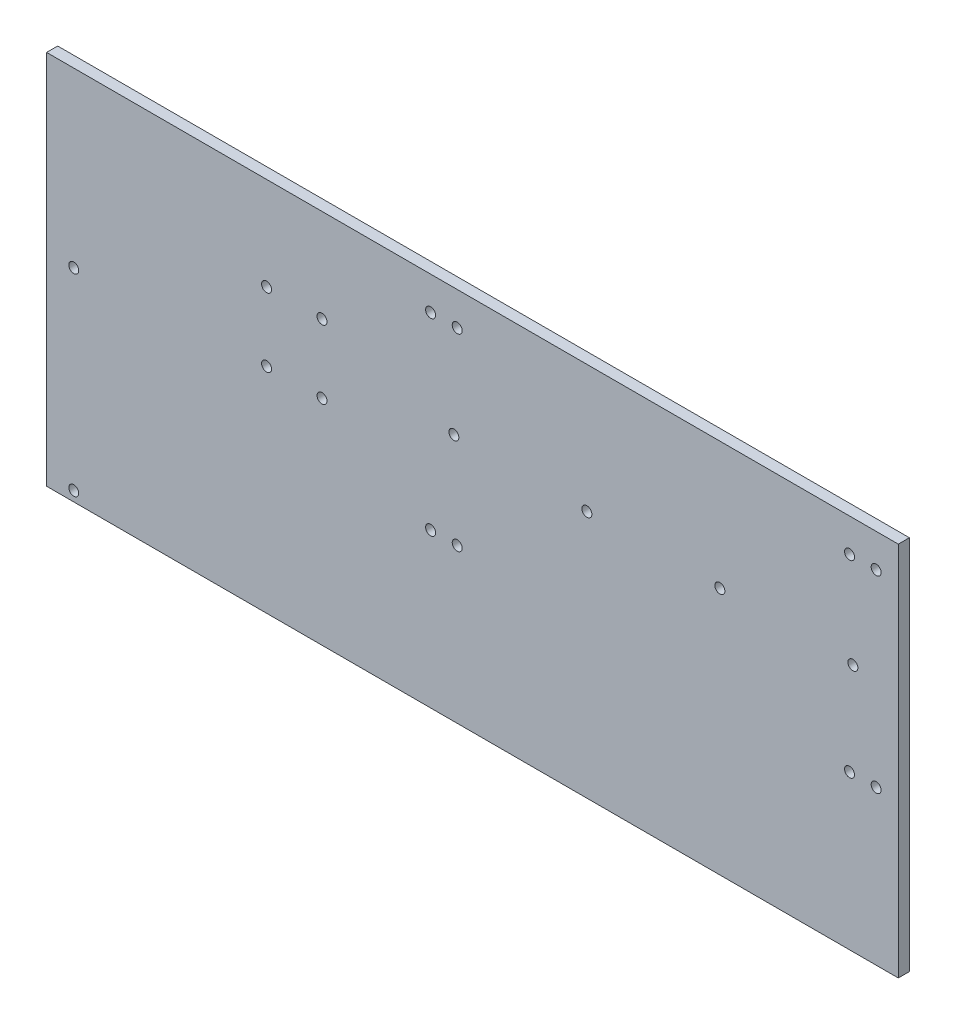
from build123d import *

# Parameters (mm, degrees)
SKETCH1_W            = 384.237886752
SKETCH1_H            = 169.516714744
BOSS_EXTRUDE1_DEPTH  = 5
M4_CLEARANCE_HOLE1_D = 4.5
M4_CLEARANCE_HOLE2_D = 4.5


with BuildPart() as part:
    # Sketch1 → Boss-Extrude1 (new body)
    with BuildSketch(Plane.XY):
        Rectangle(SKETCH1_W, SKETCH1_H)
    extrude(amount=BOSS_EXTRUDE1_DEPTH)

    # M4 Clearance Hole1 (through all)
    with Locations(Plane(origin=(0, 0, 0), x_dir=(-1, 0, 0), z_dir=(0, 0, -1))):
        with Locations((92.881056624, 42.758357372), (92.881056624, 11.758357372), (67.881056624, 11.758357372), (67.881056624, 42.758357372), (18.881056624, 69.758357372), (6.881056624, 69.758357372), (8.381056624, 27.258357372), (18.881056624, -15.241642628), (6.881056624, -15.241642628), (-51.618943376, 27.258357372), (-111.618943376, 27.258357372), (-171.618943376, 27.258357372), (-170.118943376, -15.241642628), (-182.118943376, -15.241642628), (-170.118943376, 69.758357372), (-182.118943376, 69.758357372)):
            Hole(M4_CLEARANCE_HOLE1_D / 2)

    # M4 Clearance Hole2 (through all)
    with Locations(Plane(origin=(0, 0, 0), x_dir=(-1, 0, 0), z_dir=(0, 0, -1))):
        with Locations((179.868943376, 6.741642628), (179.868943376, -80.258357372)):
            Hole(M4_CLEARANCE_HOLE2_D / 2)


solid = part.part
